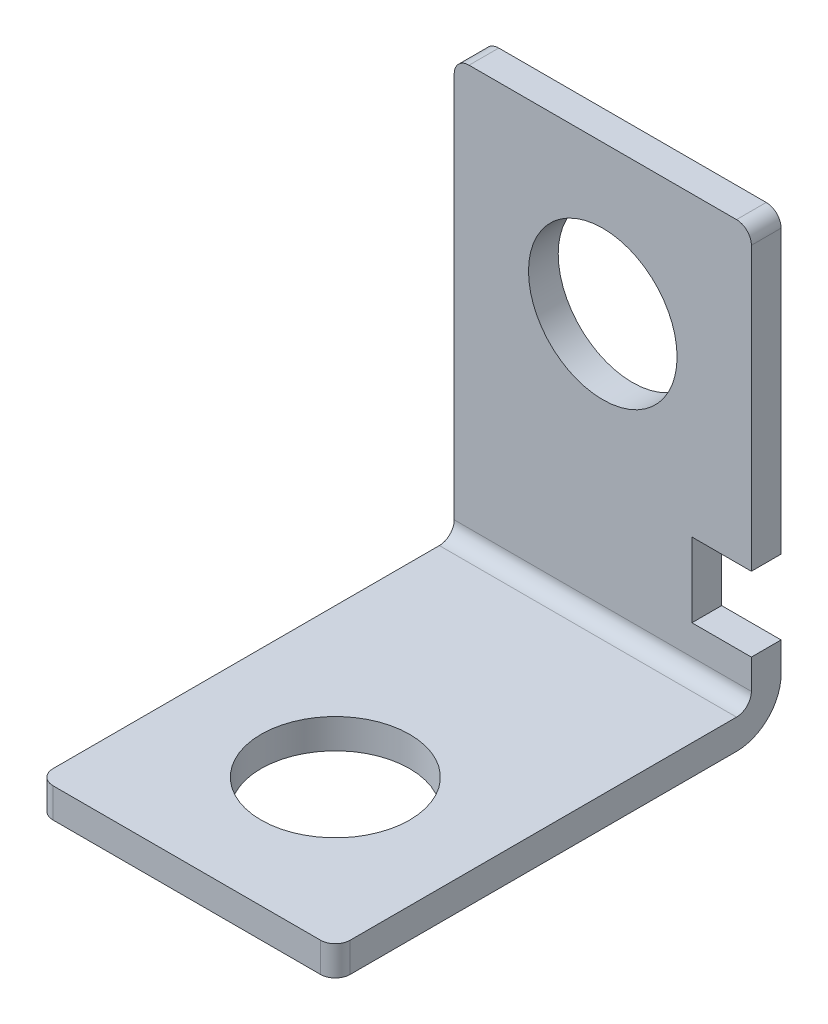
from build123d import *

# Parameters (mm, degrees)
SKETCH5_W           = 20
SKETCH5_H           = 30
SKETCH5_R           = 5
BOSS_EXTRUDE3_DEPTH = 2
SKETCH7_R           = 5
BOSS_EXTRUDE4_DEPTH = 2
FILLET3_R           = 1
FILLET4_R           = 3


with BuildPart() as part:
    # Sketch5 → Boss-Extrude3 (new body)
    with BuildSketch(Plane(origin=(0, 0, 0), x_dir=(1, 0, 0), z_dir=(0, 1, 0))):
        with Locations((10, 15)):
            Rectangle(SKETCH5_W, SKETCH5_H)
        with Locations(Location((10, 10, 0), (0, 0, 270))):
            Circle(SKETCH5_R, mode=Mode.SUBTRACT)
    extrude(amount=BOSS_EXTRUDE3_DEPTH)

    # Sketch7 → Boss-Extrude4 (add)
    with BuildSketch(Plane(origin=(0, 0, -30), x_dir=(-1, 0, 0), z_dir=(0, 0, -1))):
        Polygon((-20, 10), (-16, 10), (-16, 5), (-20, 5), (-20, 0), (0, 0), (0, 30), (-20, 30), align=None)
        with Locations((-10, 20)):
            Circle(SKETCH7_R, mode=Mode.SUBTRACT)
    extrude(amount=-BOSS_EXTRUDE4_DEPTH)

    # Fillet3
    fillet3_edges = [part.edges().sort_by_distance(p)[0] for p in [
        (10, 2, -28),
        (0, 30, -29),
        (20, 30, -29),
        (20, 1, 0),
        (0, 1, 0),
    ]]
    fillet(fillet3_edges, radius=FILLET3_R)

    # Fillet4
    fillet4_edges = [part.edges().sort_by_distance(p)[0] for p in [
        (10, 0, -30),
    ]]
    fillet(fillet4_edges, radius=FILLET4_R)


solid = part.part
